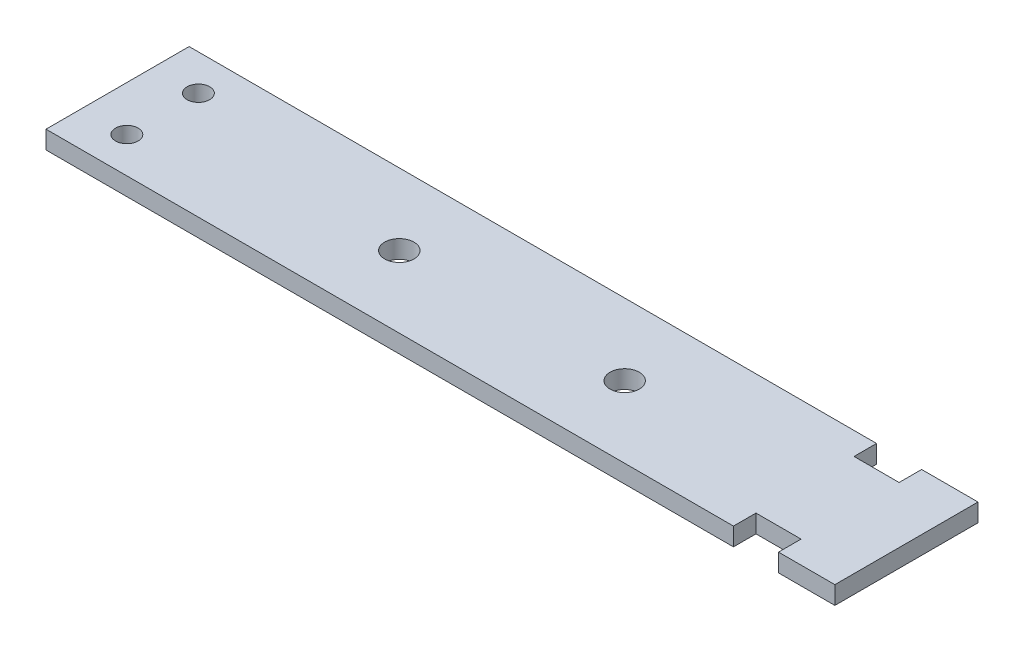
from build123d import *

# Parameters (mm, degrees)
SKETCH1_R           = 1
SKETCH1_R_2         = 1.3
BOSS_EXTRUDE1_DEPTH = 1.6


with BuildPart() as part:
    # Sketch1 → Boss-Extrude1 (new body)
    with BuildSketch(Plane(origin=(0, 0, 0), x_dir=(1, 0, 0), z_dir=(0, 1, 0))):
        Polygon((0, 0), (61, 0), (61, 2), (65, 2), (65, 0), (70, 0), (70, 12.7), (65, 12.7), (65, 10.7), (61, 10.7), (61, 12.7), (0, 12.7), align=None)
        with Locations(Location((4, 9.525, 0), (0, 0, 270))):
            Circle(SKETCH1_R, mode=Mode.SUBTRACT)
        with Locations(Location((4, 3.175, 0), (0, 0, 270))):
            Circle(SKETCH1_R, mode=Mode.SUBTRACT)
        with Locations(Location((25, 6.35, 0), (0, 0, 270))):
            Circle(SKETCH1_R_2, mode=Mode.SUBTRACT)
        with Locations(Location((45, 6.35, 0), (0, 0, 90))):
            Circle(SKETCH1_R_2, mode=Mode.SUBTRACT)
    extrude(amount=BOSS_EXTRUDE1_DEPTH)


solid = part.part
